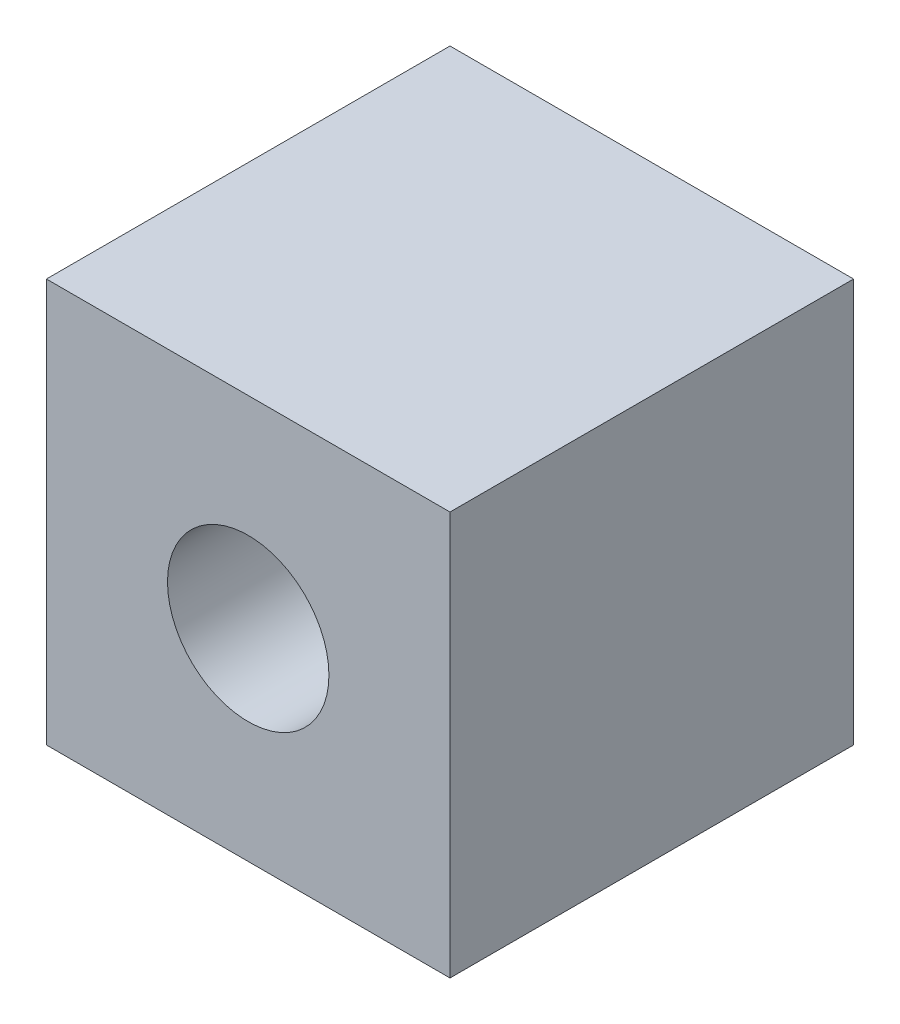
from build123d import *

# Parameters (mm, degrees)
SKETCH1_W           = 10
SKETCH1_H           = 10
BOSS_EXTRUDE1_DEPTH = 10
SKETCH2_R           = 2
CUT_EXTRUDE1_DEPTH  = 18.320508076


with BuildPart() as part:
    # Sketch1 → Boss-Extrude1 (new body)
    with BuildSketch(Plane.XY):
        with Locations((5, 5)):
            Rectangle(SKETCH1_W, SKETCH1_H)
    extrude(amount=BOSS_EXTRUDE1_DEPTH)

    # Sketch2 → Cut-Extrude1 (cut, through all)
    with BuildSketch(Plane.XY.offset(10)):
        with Locations((5, 5)):
            Circle(SKETCH2_R)
    extrude(amount=-CUT_EXTRUDE1_DEPTH, mode=Mode.SUBTRACT)


solid = part.part
